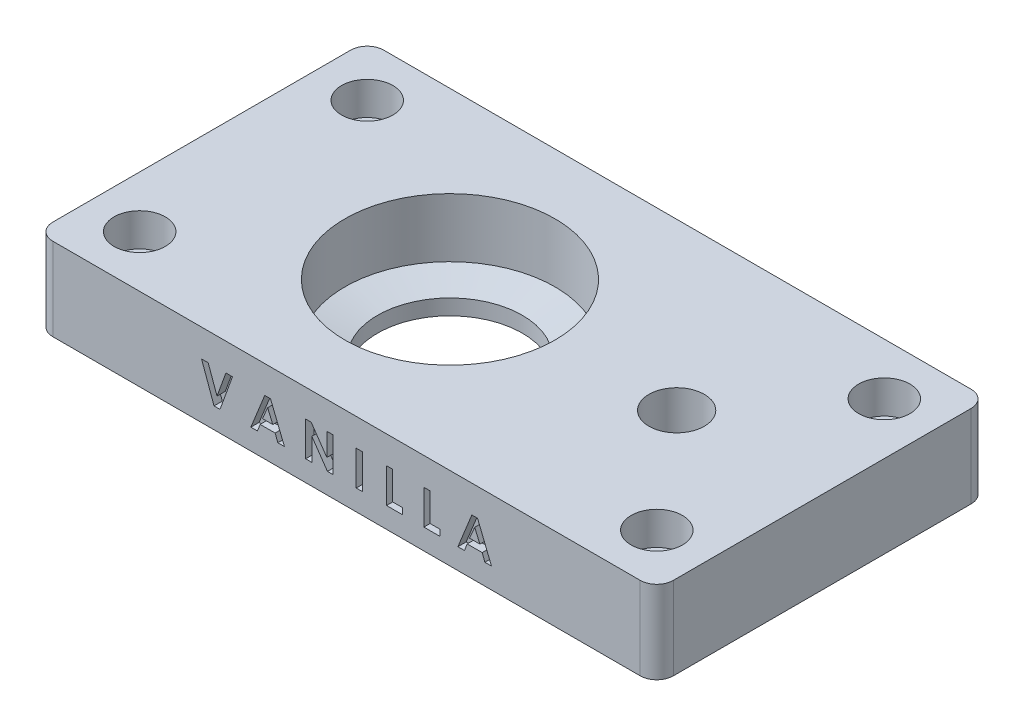
from build123d import *

# Parameters (mm, degrees)
SKETCH1_W           = 95.25
SKETCH1_H           = 50.8
BOSS_EXTRUDE1_DEPTH = 12.7
SKETCH4_R           = 2.54
CUT_EXTRUDE3_DEPTH  = 64.816710194
FILLET2_R           = 2.54
SKETCH8_R           = 4.25
CUT_EXTRUDE4_DEPTH  = 6.35
SKETCH9_W           = 0.949786324
SKETCH9_H           = 5.291666667
CUT_EXTRUDE5_DEPTH  = 1.27
SKETCH10_R          = 3.937
CUT_EXTRUDE6_DEPTH  = 5.08


with BuildPart() as part:
    # Sketch1 → Boss-Extrude1 (new body)
    with BuildSketch(Plane(origin=(0, 0, 0), x_dir=(1, 0, 0), z_dir=(0, 1, 0))):
        with Locations((9.525, 0)):
            Rectangle(SKETCH1_W, SKETCH1_H)
    extrude(amount=BOSS_EXTRUDE1_DEPTH)

    # Sketch4 → Cut-Extrude3 (cut, through all)
    with BuildSketch(Plane(origin=(0, 12.7, 0), x_dir=(1, 0, 0), z_dir=(0, 1, 0))):
        with Locations(Location((-30.1625, 17.4625, 0), (0, 0, 270))):
            Circle(SKETCH4_R)
        with Locations(Location((49.2125, 17.4625, 0), (0, 0, 270))):
            Circle(SKETCH4_R)
        with Locations(Location((49.2125, -17.4625, 0), (0, 0, 270))):
            Circle(SKETCH4_R)
        with Locations(Location((-30.1625, -17.4625, 0), (0, 0, 270))):
            Circle(SKETCH4_R)
    extrude(amount=-CUT_EXTRUDE3_DEPTH, mode=Mode.SUBTRACT)

    # Fillet2
    fillet2_edges = [part.edges().sort_by_distance(p)[0] for p in [
        (57.15, 6.35, 25.4),
        (-38.1, 6.35, 25.4),
        (-38.1, 6.35, -25.4),
        (57.15, 6.35, -25.4),
    ]]
    fillet(fillet2_edges, radius=FILLET2_R)

    # Sketch6 → Cut-Revolve1 (revolve, cut)
    with BuildSketch(Plane.XY, mode=Mode.PRIVATE) as cut_revolve1_sk:
        Polygon((0, 0), (0, 12.7), (-16.129, 12.7), (-16.129, 3.65125), (-11.1125, 2.38125), (-11.1125, 0), align=None)
    revolve(cut_revolve1_sk.sketch.rotate(Axis((0, 0, 0), (0, 1, 0)), 180), axis=Axis((0, 0, 0), (0, 1, 0)), mode=Mode.SUBTRACT)

    # Sketch8 → Cut-Extrude4 (cut)
    with BuildSketch(Plane(origin=(0, 12.7, 0), x_dir=(1, 0, 0), z_dir=(0, 1, 0))):
        with Locations(Location((34.798, 0, 0), (0, 0, 270))):
            Circle(SKETCH8_R)
    extrude(amount=-CUT_EXTRUDE4_DEPTH, mode=Mode.SUBTRACT)

    # Sketch9 → Cut-Extrude5 (cut)
    # profile 1 of 7: a face of its own
    with BuildSketch(Plane.XY.offset(25.4)):
        Polygon((-12.727136752, 8.466666667), (-11.712688635, 8.466666667), (-10.35267094, 4.707802484), (-8.989473157, 8.466666667), (-7.978205128, 8.466666667), (-9.896858307, 3.175), (-10.811663662, 3.175), align=None)
    # profile 2 of 7: a face of its own
    with BuildSketch(Plane.XY.offset(25.4)):
        Polygon((-3.024687834, 8.466666667), (-2.143803419, 8.466666667), (-0.006784188, 3.175), (-1.021232305, 3.175), (-1.432523705, 4.260470085), (-3.738087607, 4.260470085), (-4.149379006, 3.175), (-5.162767094, 3.175), align=None)
        Polygon((-2.584775641, 7.047287326), (-3.377677618, 5.21025641), (-1.791873665, 5.21025641), align=None, mode=Mode.SUBTRACT)
    # profile 3 of 7: a face of its own
    with BuildSketch(Plane.XY.offset(25.4)):
        Polygon((3.249626068, 8.466666667), (4.105069778, 8.466666667), (6.506036325, 4.984470152), (6.506036325, 8.466666667), (7.45582265, 8.466666667), (7.45582265, 3.175), (6.594018763, 3.175), (4.199412393, 6.646596221), (4.199412393, 3.175), (3.249626068, 3.175), align=None)
    # profile 4 of 7: a face of its own
    with BuildSketch(Plane.XY.offset(25.4)):
        with Locations((11.49241453, 5.820833334)):
            Rectangle(SKETCH9_W, SKETCH9_H)
    # profile 5 of 7: a face of its own
    with BuildSketch(Plane.XY.offset(25.4)):
        Polygon((15.664690171, 8.466666667), (16.614476496, 8.466666667), (16.614476496, 4.124786325), (18.106997863, 4.124786325), (18.106997863, 3.175), (15.664690171, 3.175), align=None)
    # profile 6 of 7: a face of its own
    with BuildSketch(Plane.XY.offset(25.4)):
        Polygon((21.39732906, 8.466666667), (22.347115385, 8.466666667), (22.347115385, 4.124786325), (23.839636752, 4.124786325), (23.839636752, 3.175), (21.39732906, 3.175), align=None)
    # profile 7 of 7: a face of its own
    with BuildSketch(Plane.XY.offset(25.4)):
        Polygon((28.759233106, 8.466666667), (29.640117521, 8.466666667), (31.777136752, 3.175), (30.762688635, 3.175), (30.351397236, 4.260470085), (28.045833333, 4.260470085), (27.634541934, 3.175), (26.621153846, 3.175), align=None)
        Polygon((29.199145299, 7.047287326), (28.406243323, 5.21025641), (29.992047276, 5.21025641), align=None, mode=Mode.SUBTRACT)
    extrude(amount=-CUT_EXTRUDE5_DEPTH, mode=Mode.SUBTRACT)

    # Sketch10 → Cut-Extrude6 (cut)
    with BuildSketch(Plane(origin=(0, 12.7, 0), x_dir=(1, 0, 0), z_dir=(0, 1, 0))):
        with Locations(Location((-30.1625, 17.4625, 0), (0, 0, 270))):
            Circle(SKETCH10_R)
        with Locations(Location((-30.1625, -17.4625, 0), (0, 0, 270))):
            Circle(SKETCH10_R)
        with Locations(Location((49.2125, 17.4625, 0), (0, 0, 270))):
            Circle(SKETCH10_R)
        with Locations(Location((49.2125, -17.4625, 0), (0, 0, 270))):
            Circle(SKETCH10_R)
    extrude(amount=-CUT_EXTRUDE6_DEPTH, mode=Mode.SUBTRACT)


solid = part.part
